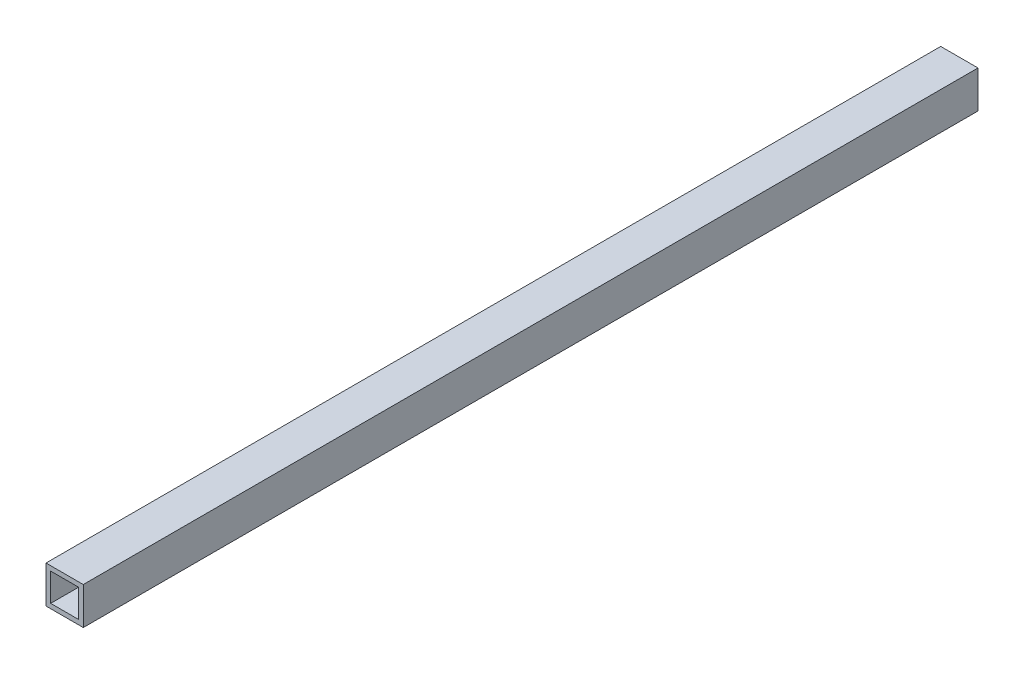
from build123d import *

# Parameters (mm, degrees)
SKETCH1_W           = 25.4
SKETCH1_H           = 25.4
SKETCH1_W_2         = 19.05
SKETCH1_H_2         = 19.05
BOSS_EXTRUDE1_DEPTH = 609.6


with BuildPart() as part:
    # Sketch1 → Boss-Extrude1 (new body)
    with BuildSketch(Plane.XY):
        Rectangle(SKETCH1_W, SKETCH1_H)
        Rectangle(SKETCH1_W_2, SKETCH1_H_2, mode=Mode.SUBTRACT)
    extrude(amount=BOSS_EXTRUDE1_DEPTH)


solid = part.part
